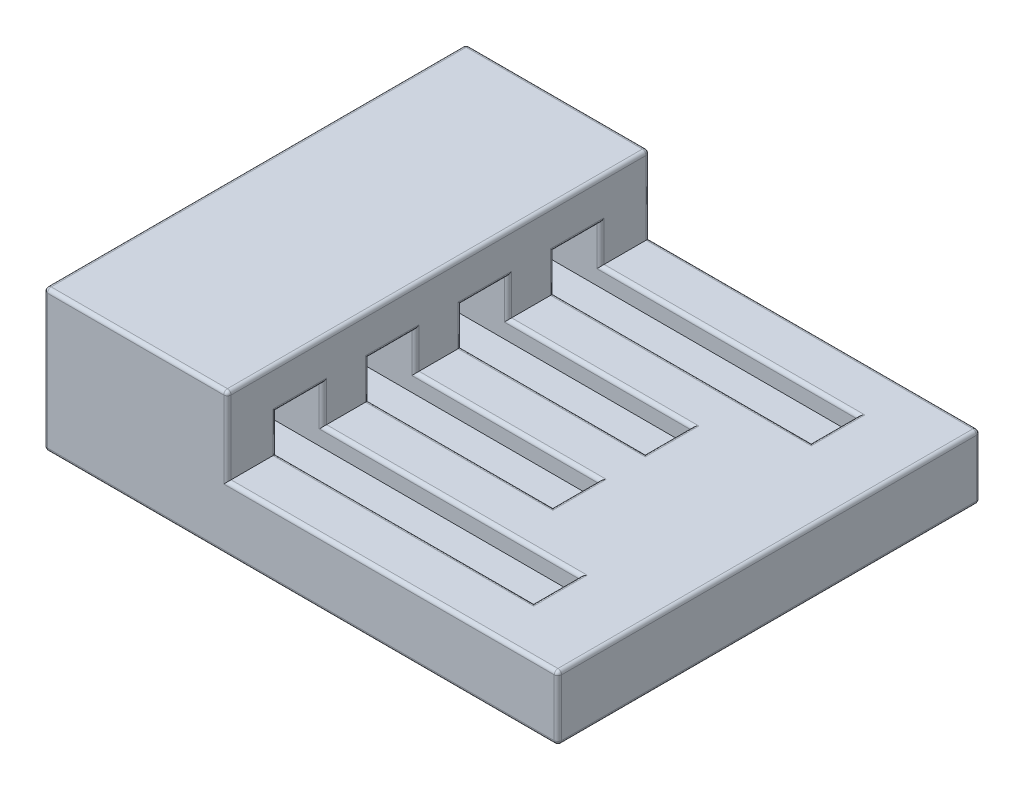
from build123d import *

# Parameters (mm, degrees)
BOSS_EXTRUDE1_DEPTH     = 5.75
CUT_EXTRUDE1_DEPTH      = 1
CUT_EXTRUDE1_DEPTH_BACK = 0.5
SKETCH2_W               = 12
SKETCH2_H               = 1.26
SKETCH2_W_2             = 10
FILLET1_R               = 0.1


with BuildPart() as part:
    # Sketch1 → Boss-Extrude1 (new, symmetric)
    with BuildSketch(Plane.XY):
        Polygon((5, 3.85), (5, 1.75), (14, 1.75), (14, 0), (5, 0), (0, 0), (0, 3.85), align=None)
    extrude(amount=BOSS_EXTRUDE1_DEPTH, both=True)

    # Sketch2 → Cut-Extrude1 (cut, two sides: drawn at the far end of the back side and taken through both)
    with BuildSketch(Plane(origin=(0, 1.75, 0), x_dir=(1, 0, 0), z_dir=(0, 1, 0)).offset(-CUT_EXTRUDE1_DEPTH_BACK)):
        with Locations((6, 3.78)):
            Rectangle(SKETCH2_W, SKETCH2_H)
        with Locations((5, 1.26)):
            Rectangle(SKETCH2_W_2, SKETCH2_H)
        with Locations((5, -1.26)):
            Rectangle(SKETCH2_W_2, SKETCH2_H)
        with Locations((6, -3.78)):
            Rectangle(SKETCH2_W, SKETCH2_H)
    extrude(amount=CUT_EXTRUDE1_DEPTH + CUT_EXTRUDE1_DEPTH_BACK, mode=Mode.SUBTRACT)

    # Fillet1
    fillet1_edges = [part.edges().sort_by_distance(p)[0] for p in [
        (0, 3.85, 0),
        (5, 3.85, 0),
        (14, 1.75, 0),
        (14, 0, 0),
        (0, 0, 0),
        (14, 0.875, 5.75),
        (9.5, 1.75, 5.75),
        (5, 2.8, 5.75),
        (2.5, 3.85, 5.75),
        (5, 2.75, 3.78),
        (5, 2.25, 3.15),
        (5, 2.25, 4.41),
        (5, 2.75, 1.26),
        (5, 2.25, 0.63),
        (5, 2.25, 1.89),
        (5, 2.75, -1.26),
        (5, 2.25, -1.89),
        (5, 2.25, -0.63),
        (5, 2.75, -3.78),
        (5, 2.25, -4.41),
        (5, 2.25, -3.15),
        (12, 1.75, 3.78),
        (10, 1.75, 1.26),
        (10, 1.75, -1.26),
        (12, 1.75, -3.78),
        (0, 1.925, 5.75),
        (0, 2, -3.15),
        (0, 2.75, -3.78),
        (0, 2, -4.41),
        (0, 1.25, -3.78),
        (8.5, 1.75, -3.15),
        (8.5, 1.75, -4.41),
        (0, 2, -0.63),
        (0, 2.75, -1.26),
        (0, 2, -1.89),
        (0, 1.25, -1.26),
        (7.5, 1.75, -0.63),
        (7.5, 1.75, -1.89),
        (0, 2, 1.89),
        (0, 2.75, 1.26),
        (7.5, 1.75, 1.89),
        (7.5, 1.75, 0.63),
        (0, 2, 0.63),
        (0, 1.25, 1.26),
        (2.5, 3.85, -5.75),
        (7, 0, 5.75),
        (0, 2, 4.41),
        (0, 2.75, 3.78),
        (8.5, 1.75, 4.41),
        (8.5, 1.75, 3.15),
        (0, 2, 3.15),
        (0, 1.25, 3.78),
        (5, 2.8, -5.75),
        (9.5, 1.75, -5.75),
        (14, 0.875, -5.75),
        (7, 0, -5.75),
        (0, 1.925, -5.75),
    ]]
    fillet(fillet1_edges, radius=FILLET1_R)


solid = part.part
